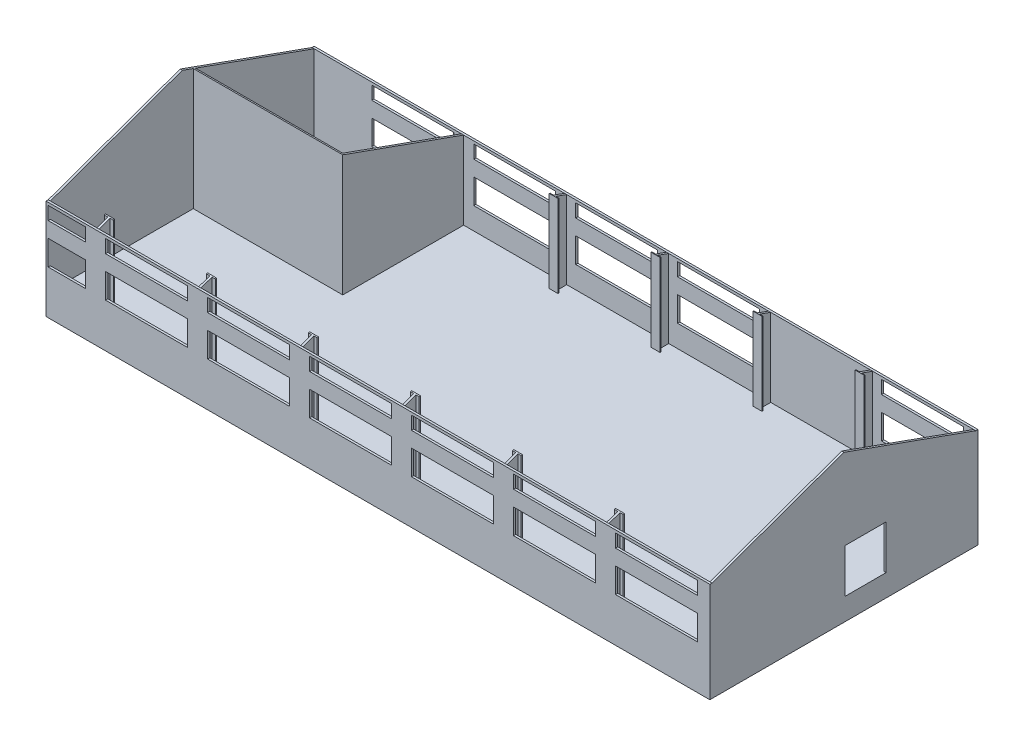
from build123d import *

# Parameters (mm, degrees)
SKETCH_3_W          = 30000
SKETCH_3_H          = 12000
EXTRUDE_2_DEPTH     = 1000
EXTRUDE_3_DEPTH     = 100
EXTRUDE_4_DEPTH     = 100
SKETCH_8_W          = 30200
SKETCH_8_H          = 4550
EXTRUDE_5_DEPTH     = 100
SKETCH_9_W          = 30200
SKETCH_9_H          = 4550
EXTRUDE_7_DEPTH     = 100
EXTRUDE_8_DEPTH     = 5700
SKETCH_13_W         = 1880
SKETCH_13_H         = 2000
CUT_EXTRUDE_3_DEPTH = 100
EXTRUDE_9_DEPTH     = 4000
SKETCH_15_W         = 3730
SKETCH_15_H         = 1130
SKETCH_15_H_2       = 600
CUT_EXTRUDE_4_DEPTH = 100
SKETCH_16_W         = 3730
SKETCH_16_H         = 1130
SKETCH_16_H_2       = 600
SKETCH_16_W_2       = 1700
CUT_EXTRUDE_5_DEPTH = 100
CUT_EXTRUDE_2_DEPTH = 33115.053652375


with BuildPart() as part:
    # ｽｹｯﾁ3 → ﾎﾞｽ - 押し出し2 (new body)
    with BuildSketch(Plane(origin=(0, 0, 0), x_dir=(1, 0, 0), z_dir=(0, 1, 0))):
        with Locations((14904.357945066, 5968.16263117)):
            Rectangle(SKETCH_3_W, SKETCH_3_H)
    extrude(amount=EXTRUDE_2_DEPTH)

    # ｽｹｯﾁ4 → ﾎﾞｽ - 押し出し3 (add)
    with BuildSketch(Plane(origin=(29904.357945066, 0, 0), x_dir=(0, 0, -1), z_dir=(1, 0, 0))):
        Polygon((-31.83736883, 0), (-31.83736883, 4550), (5968.16263117, 6700), (11968.16263117, 4550), (11968.16263117, 0), align=None)
    extrude(amount=EXTRUDE_3_DEPTH)

    # ｽｹｯﾁ7 → ﾎﾞｽ - 押し出し4 (add)
    with BuildSketch(Plane.ZY.offset(95.642054934)):
        Polygon((-11968.16263117, 0), (-11968.16263117, 4550), (-5968.16263117, 6700), (31.83736883, 4550), (31.83736883, 0), align=None)
    extrude(amount=EXTRUDE_4_DEPTH)

    # ｽｹｯﾁ8 → ﾎﾞｽ - 押し出し5 (add)
    with BuildSketch(Plane(origin=(0, 0, -11968.16263117), x_dir=(-1, 0, 0), z_dir=(0, 0, -1))):
        with Locations((-14904.357945066, 2275)):
            Rectangle(SKETCH_8_W, SKETCH_8_H)
    extrude(amount=EXTRUDE_5_DEPTH)

    # ｽｹｯﾁ9 → ﾎﾞｽ - 押し出し7 (add)
    with BuildSketch(Plane.XY.offset(31.83736883)):
        with Locations((14904.357945066, 2275)):
            Rectangle(SKETCH_9_W, SKETCH_9_H)
    extrude(amount=EXTRUDE_7_DEPTH)

    # ｽｹｯﾁ10 → ﾎﾞｽ - 押し出し8 (add)
    with BuildSketch(Plane(origin=(0, 1000, 0), x_dir=(1, 0, 0), z_dir=(0, 1, 0))):
        Polygon((-95.642054934, 6568.16263117), (6604.357945066, 6568.16263117), (6604.357945066, 11968.16263117), (6704.357945066, 11968.16263117), (6704.357945066, 6468.16263117), (-95.642054934, 6468.16263117), align=None)
    extrude(amount=EXTRUDE_8_DEPTH)

    # ｽｹｯﾁ13 → ｶｯﾄ - 押し出し3 (cut)
    with BuildSketch(Plane.ZY.offset(-29904.357945066)):
        with Locations((-6948.16263117, 2000)):
            Rectangle(SKETCH_13_W, SKETCH_13_H)
    extrude(amount=-CUT_EXTRUDE_3_DEPTH, mode=Mode.SUBTRACT)

    # ｽｹｯﾁ14 → ﾎﾞｽ - 押し出し9 (add)
    with BuildSketch(Plane(origin=(0, 1000, 0), x_dir=(1, 0, 0), z_dir=(0, 1, 0))):
        Polygon((25314.357945066, 11968.16263117), (25314.357945066, 11468.16263117), (25464.357945066, 11468.16263117), (25464.357945066, 11418.16263117), (25064.357945066, 11418.16263117), (25064.357945066, 11468.16263117), (25214.357945066, 11468.16263117), (25214.357945066, 11968.16263117), align=None)
        Polygon((20674.357945066, 11968.16263117), (20674.357945066, 11468.16263117), (20824.357945066, 11468.16263117), (20824.357945066, 11418.16263117), (20424.357945066, 11418.16263117), (20424.357945066, 11468.16263117), (20574.357945066, 11468.16263117), (20574.357945066, 11968.16263117), align=None)
        Polygon((16034.357945066, 11968.16263117), (16034.357945066, 11468.16263117), (16184.357945066, 11468.16263117), (16184.357945066, 11418.16263117), (15784.357945066, 11418.16263117), (15784.357945066, 11468.16263117), (15934.357945066, 11468.16263117), (15934.357945066, 11968.16263117), align=None)
        Polygon((11394.357945066, 11968.16263117), (11394.357945066, 11468.16263117), (11544.357945066, 11468.16263117), (11544.357945066, 11418.16263117), (11144.357945066, 11418.16263117), (11144.357945066, 11468.16263117), (11294.357945066, 11468.16263117), (11294.357945066, 11968.16263117), align=None)
        Polygon((2014.357945066, -31.83736883), (2014.357945066, 468.16263117), (1864.357945066, 468.16263117), (1864.357945066, 518.16263117), (2264.357945066, 518.16263117), (2264.357945066, 468.16263117), (2114.357945066, 468.16263117), (2114.357945066, -31.83736883), align=None)
        Polygon((25214.357945066, -31.83736883), (25214.357945066, 468.16263117), (25064.357945066, 468.16263117), (25064.357945066, 518.16263117), (25464.357945066, 518.16263117), (25464.357945066, 468.16263117), (25314.357945066, 468.16263117), (25314.357945066, -31.83736883), align=None)
        Polygon((20574.357945066, -31.83736883), (20574.357945066, 468.16263117), (20424.357945066, 468.16263117), (20424.357945066, 518.16263117), (20824.357945066, 518.16263117), (20824.357945066, 468.16263117), (20674.357945066, 468.16263117), (20674.357945066, -31.83736883), align=None)
        Polygon((15934.357945066, -31.83736883), (15934.357945066, 468.16263117), (15784.357945066, 468.16263117), (15784.357945066, 518.16263117), (16184.357945066, 518.16263117), (16184.357945066, 468.16263117), (16034.357945066, 468.16263117), (16034.357945066, -31.83736883), align=None)
        Polygon((11294.357945066, -31.83736883), (11294.357945066, 468.16263117), (11144.357945066, 468.16263117), (11144.357945066, 518.16263117), (11544.357945066, 518.16263117), (11544.357945066, 468.16263117), (11394.357945066, 468.16263117), (11394.357945066, -31.83736883), align=None)
        Polygon((6654.357945066, -31.83736883), (6654.357945066, 468.16263117), (6504.357945066, 468.16263117), (6504.357945066, 518.16263117), (6904.357945066, 518.16263117), (6904.357945066, 468.16263117), (6754.357945066, 468.16263117), (6754.357945066, -31.83736883), align=None)
    extrude(amount=EXTRUDE_9_DEPTH)

    # ｽｹｯﾁ15 → ｶｯﾄ - 押し出し4 (cut)
    with BuildSketch(Plane.XY.offset(-11968.16263117)):
        with Locations((27579.357945066, 2565)):
            Rectangle(SKETCH_15_W, SKETCH_15_H)
        with Locations((27579.357945066, 4130)):
            Rectangle(SKETCH_15_W, SKETCH_15_H_2)
        with Locations((18304.357945066, 2565)):
            Rectangle(SKETCH_15_W, SKETCH_15_H)
        with Locations((18304.357945066, 4130)):
            Rectangle(SKETCH_15_W, SKETCH_15_H_2)
        with Locations((13666.857945066, 2565)):
            Rectangle(SKETCH_15_W, SKETCH_15_H)
        with Locations((13666.857945066, 4130)):
            Rectangle(SKETCH_15_W, SKETCH_15_H_2)
        with Locations((9029.357945066, 2565)):
            Rectangle(SKETCH_15_W, SKETCH_15_H)
        with Locations((9029.357945066, 4130)):
            Rectangle(SKETCH_15_W, SKETCH_15_H_2)
        with Locations((4389.357945066, 2565)):
            Rectangle(SKETCH_15_W, SKETCH_15_H)
        with Locations((4389.357945066, 4130)):
            Rectangle(SKETCH_15_W, SKETCH_15_H_2)
    extrude(amount=-CUT_EXTRUDE_4_DEPTH, mode=Mode.SUBTRACT)

    # ｽｹｯﾁ16 → ｶｯﾄ - 押し出し5 (cut)
    with BuildSketch(Plane(origin=(0, 0, 31.83736883), x_dir=(-1, 0, 0), z_dir=(0, 0, -1))):
        with Locations((-27579.357945066, 2565)):
            Rectangle(SKETCH_16_W, SKETCH_16_H)
        with Locations((-27579.357945066, 4130)):
            Rectangle(SKETCH_16_W, SKETCH_16_H_2)
        with Locations((-22939.357945066, 2565)):
            Rectangle(SKETCH_16_W, SKETCH_16_H)
        with Locations((-22939.357945066, 4130)):
            Rectangle(SKETCH_16_W, SKETCH_16_H_2)
        with Locations((-18299.357945066, 2565)):
            Rectangle(SKETCH_16_W, SKETCH_16_H)
        with Locations((-18299.357945066, 4130)):
            Rectangle(SKETCH_16_W, SKETCH_16_H_2)
        with Locations((-13659.357945066, 2565)):
            Rectangle(SKETCH_16_W, SKETCH_16_H)
        with Locations((-13659.357945066, 4130)):
            Rectangle(SKETCH_16_W, SKETCH_16_H_2)
        with Locations((-9019.357945066, 2565)):
            Rectangle(SKETCH_16_W, SKETCH_16_H)
        with Locations((-9019.357945066, 4130)):
            Rectangle(SKETCH_16_W, SKETCH_16_H_2)
        with Locations((-4379.357945066, 2565)):
            Rectangle(SKETCH_16_W, SKETCH_16_H)
        with Locations((-4379.357945066, 4130)):
            Rectangle(SKETCH_16_W, SKETCH_16_H_2)
        with Locations((-754.357945066, 2565)):
            Rectangle(SKETCH_16_W_2, SKETCH_16_H)
        with Locations((-754.357945066, 4130)):
            Rectangle(SKETCH_16_W_2, SKETCH_16_H_2)
    extrude(amount=-CUT_EXTRUDE_5_DEPTH, mode=Mode.SUBTRACT)

    # ｽｹｯﾁ12 → ｶｯﾄ - 押し出し2 (cut, through all)
    with BuildSketch(Plane.ZY.offset(95.642054934)):
        Polygon((-6468.16263117, 6520.833333333), (-11968.16263117, 4550), (-11968.16263117, 6700), (-6468.16263117, 6700), align=None)
        Polygon((-5968.16263117, 6700), (31.83736883, 6700), (31.83736883, 4550), align=None)
    extrude(amount=-CUT_EXTRUDE_2_DEPTH, mode=Mode.SUBTRACT)


solid = part.part
